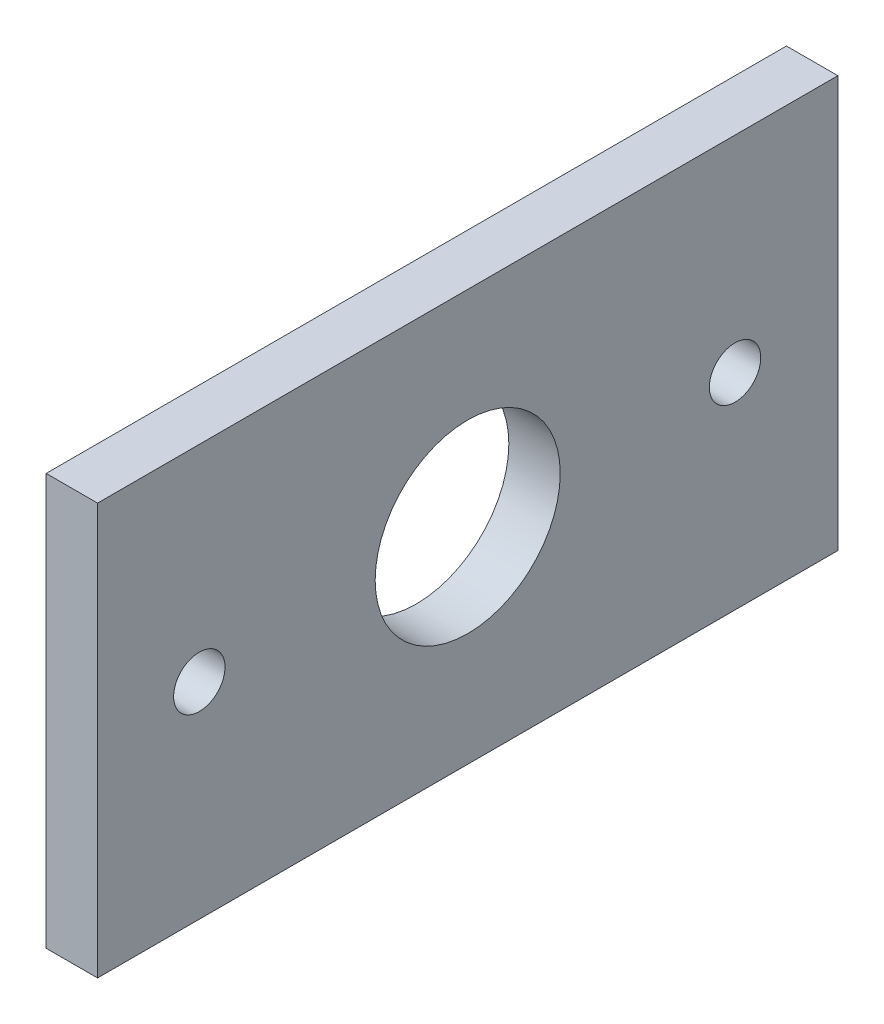
from build123d import *

# Parameters (mm, degrees)
SKETCH1_W           = 72
SKETCH1_H           = 40
SKETCH1_R           = 9
SKETCH1_R_2         = 2.5
BOSS_EXTRUDE1_DEPTH = 5


with BuildPart() as part:
    # Sketch1 → Boss-Extrude1 (new body)
    with BuildSketch(Plane(origin=(0, 0, 0), x_dir=(0, 0, -1), z_dir=(1, 0, 0))):
        with Locations((36, -20)):
            Rectangle(SKETCH1_W, SKETCH1_H)
        with Locations((36, -20)):
            Circle(SKETCH1_R, mode=Mode.SUBTRACT)
        with Locations((9.896254834, -20)):
            Circle(SKETCH1_R_2, mode=Mode.SUBTRACT)
        with Locations((62, -20)):
            Circle(SKETCH1_R_2, mode=Mode.SUBTRACT)
    extrude(amount=BOSS_EXTRUDE1_DEPTH)


solid = part.part
